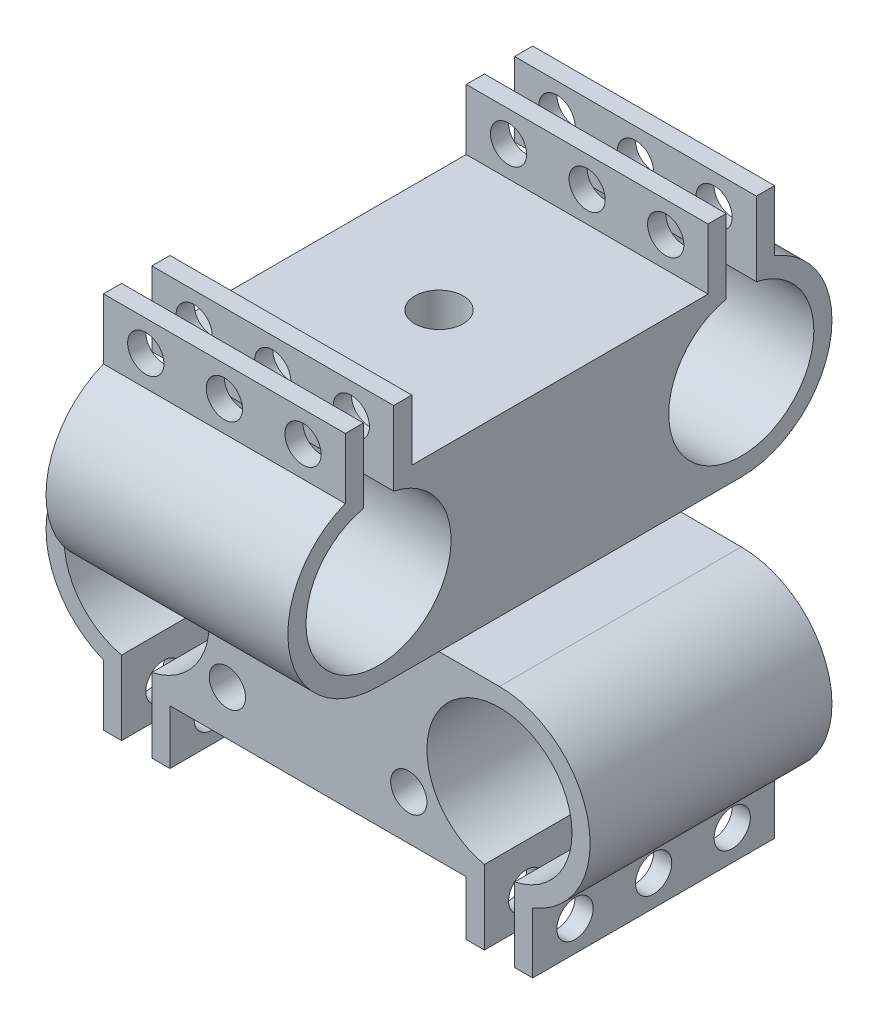
from build123d import *

# Parameters (mm, degrees)
EXTRUDE_1_DEPTH     = 20
SKETCH_2_R          = 1.5
CUT_EXTRUDE_1_DEPTH = 47.519485165
SKETCH_5_W          = 1.5
SKETCH_5_H          = 4.502682252
EXTRUDE_2_DEPTH     = 10
SKETCH_6_R          = 1.5
CUT_EXTRUDE_2_DEPTH = 54.43647957
SKETCH_7_R          = 2
CUT_EXTRUDE_3_DEPTH = 53.126408809
SKETCH_8_R          = 8
CUT_EXTRUDE_4_DEPTH = 10
SKETCH_9_R          = 1.5
CUT_EXTRUDE_5_DEPTH = 54.307080663


with BuildPart() as part:
    # 스케치1 → 보스-돌출1 (new body)
    with BuildSketch(Plane(origin=(0, 0, 0), x_dir=(0, 0, -1), z_dir=(1, 0, 0))):
        with BuildLine():
            ThreePointArc((-12.25, 6.977642868), (-7.631746424, -1.399585383), (-15, -7.5))
            Line((-15, -7.5), (15, -7.5))
            ThreePointArc((15, -7.5), (7.631746424, -1.399585383), (12.25, 6.977642868))
            Line((12.25, 6.977642868), (-12.25, 6.977642868))
        make_face()
        with BuildLine():
            Line((-17.75, 5.332682252), (-17.75, 6.977642868))
            ThreePointArc((-17.75, 6.977642868), (-22.368253576, -1.399585383), (-15, -7.5))
            ThreePointArc((-15, -7.5), (-7.631746424, -1.399585383), (-12.25, 6.977642868))
            Line((-12.25, 6.977642868), (-12.25, 5.332682252))
            ThreePointArc((-12.25, 5.332682252), (-15, -6), (-17.75, 5.332682252))
        make_face()
        with BuildLine():
            ThreePointArc((-13.75, 5.868347297), (-12.982146125, 5.650510219), (-12.25, 5.332682252))
            Line((-12.25, 5.332682252), (-12.25, 6.977642868))
            ThreePointArc((-12.25, 6.977642868), (-12.989137608, 7.225401888), (-13.75, 7.395099729))
            Line((-13.75, 7.395099729), (-13.75, 5.868347297))
        make_face()
        with BuildLine():
            ThreePointArc((-16.25, 7.395099729), (-17.010862392, 7.225401888), (-17.75, 6.977642868))
            Line((-17.75, 6.977642868), (-17.75, 5.332682252))
            ThreePointArc((-17.75, 5.332682252), (-17.017853875, 5.650510219), (-16.25, 5.868347297))
            Line((-16.25, 5.868347297), (-16.25, 7.395099729))
        make_face()
        with BuildLine():
            Line((-16.25, 12), (-17.75, 12))
            Line((-17.75, 12), (-17.75, 6.977642868))
            ThreePointArc((-17.75, 6.977642868), (-17.010862392, 7.225401888), (-16.25, 7.395099729))
            Line((-16.25, 7.395099729), (-16.25, 10.5))
            Line((-16.25, 10.5), (-16.25, 12))
        make_face()
        with BuildLine():
            ThreePointArc((-13.75, 7.395099729), (-12.989137608, 7.225401888), (-12.25, 6.977642868))
            Line((-12.25, 6.977642868), (-12.25, 12))
            Line((-12.25, 12), (-13.75, 12))
            Line((-13.75, 12), (-13.75, 10.5))
            Line((-13.75, 10.5), (-13.75, 7.395099729))
        make_face()
        with BuildLine():
            ThreePointArc((12.25, 6.977642868), (7.631746424, -1.399585383), (15, -7.5))
            ThreePointArc((15, -7.5), (22.368253576, -1.399585383), (17.75, 6.977642868))
            Line((17.75, 6.977642868), (17.75, 5.332682252))
            ThreePointArc((17.75, 5.332682252), (15, -6), (12.25, 5.332682252))
            Line((12.25, 5.332682252), (12.25, 6.977642868))
        make_face()
        with BuildLine():
            Line((17.75, 5.332682252), (17.75, 6.977642868))
            ThreePointArc((17.75, 6.977642868), (17.010862392, 7.225401888), (16.25, 7.395099729))
            Line((16.25, 7.395099729), (16.25, 5.868347297))
            ThreePointArc((16.25, 5.868347297), (17.017853875, 5.650510219), (17.75, 5.332682252))
        make_face()
        with BuildLine():
            ThreePointArc((16.25, 7.395099729), (17.010862392, 7.225401888), (17.75, 6.977642868))
            Line((17.75, 6.977642868), (17.75, 12))
            Line((17.75, 12), (16.25, 12))
            Line((16.25, 12), (16.25, 10.5))
            Line((16.25, 10.5), (16.25, 7.395099729))
        make_face()
        with BuildLine():
            Line((12.25, 12), (12.25, 6.977642868))
            ThreePointArc((12.25, 6.977642868), (12.989137608, 7.225401888), (13.75, 7.395099729))
            Line((13.75, 7.395099729), (13.75, 10.5))
            Line((13.75, 10.5), (13.75, 12))
            Line((13.75, 12), (12.25, 12))
        make_face()
        with BuildLine():
            ThreePointArc((13.75, 7.395099729), (12.989137608, 7.225401888), (12.25, 6.977642868))
            Line((12.25, 6.977642868), (12.25, 5.332682252))
            ThreePointArc((12.25, 5.332682252), (12.982146125, 5.650510219), (13.75, 5.868347297))
            Line((13.75, 5.868347297), (13.75, 7.395099729))
        make_face()
    extrude(amount=EXTRUDE_1_DEPTH)

    # 스케치2 → 컷-돌출1 (cut, through all)
    with BuildSketch(Plane.XY.offset(17.75)):
        with Locations((3.5, 9.488821434)):
            Circle(SKETCH_2_R)
        with Locations((10, 9.488821434)):
            Circle(SKETCH_2_R)
        with Locations(Location((16.5, 9.488821434, 0), (0, 0, 90))):
            Circle(SKETCH_2_R)
    extrude(amount=-CUT_EXTRUDE_1_DEPTH, mode=Mode.SUBTRACT)

    # 스케치5 → 보스-돌출2 (add, symmetric)
    with BuildSketch(Plane.XY):
        with BuildLine():
            ThreePointArc((32.5, -15), (30.303300859, -9.696699141), (25, -7.5))
            ThreePointArc((25, -7.5), (17.631746424, -13.600414617), (22.25, -21.977642868))
            Line((22.25, -21.977642868), (22.25, -20.332682252))
            ThreePointArc((22.25, -20.332682252), (21.877501001, -9.876524617), (31, -15))
            ThreePointArc((31, -15), (30.123475383, -18.122498999), (27.75, -20.332682252))
            Line((27.75, -20.332682252), (27.75, -21.977642868))
            ThreePointArc((27.75, -21.977642868), (31.199798384, -19.220485754), (32.5, -15))
        make_face()
        with BuildLine():
            Line((22.25, -20.332682252), (22.25, -21.977642868))
            ThreePointArc((22.25, -21.977642868), (22.989137608, -22.225401888), (23.75, -22.395099729))
            Line((23.75, -22.395099729), (23.75, -20.868347297))
            ThreePointArc((23.75, -20.868347297), (22.982146125, -20.650510219), (22.25, -20.332682252))
        make_face()
        with BuildLine():
            ThreePointArc((26.25, -22.395099729), (27.010862392, -22.225401888), (27.75, -21.977642868))
            Line((27.75, -21.977642868), (27.75, -20.332682252))
            ThreePointArc((27.75, -20.332682252), (27.017853875, -20.650510219), (26.25, -20.868347297))
            Line((26.25, -20.868347297), (26.25, -22.395099729))
        make_face()
        with BuildLine():
            Line((27.75, -27.002682252), (27.75, -21.977642868))
            ThreePointArc((27.75, -21.977642868), (27.010862392, -22.225401888), (26.25, -22.395099729))
            Line((26.25, -22.395099729), (26.25, -27.002682252))
            Line((26.25, -27.002682252), (27.75, -27.002682252))
        make_face()
        with BuildLine():
            ThreePointArc((23.75, -22.395099729), (22.989137608, -22.225401888), (22.25, -21.977642868))
            Line((22.25, -21.977642868), (22.25, -22.5))
            Line((22.25, -22.5), (23.75, -22.5))
            Line((23.75, -22.5), (23.75, -22.395099729))
        make_face()
        with Locations((23, -24.751341126)):
            Rectangle(SKETCH_5_W, SKETCH_5_H)
        with BuildLine():
            ThreePointArc((22.25, -21.977642868), (17.631746424, -13.600414617), (25, -7.5))
            Line((25, -7.5), (20, -7.5))
            Line((20, -7.5), (0, -7.5))
            Line((0, -7.5), (-5, -7.5))
            ThreePointArc((-5, -7.5), (0.303300859, -9.696699141), (2.5, -15))
            ThreePointArc((2.5, -15), (1.199798384, -19.220485754), (-2.25, -21.977642868))
            Line((-2.25, -21.977642868), (-2.25, -22.5))
            Line((-2.25, -22.5), (22.25, -22.5))
            Line((22.25, -22.5), (22.25, -21.977642868))
        make_face()
        with BuildLine():
            ThreePointArc((2.5, -15), (0.303300859, -9.696699141), (-5, -7.5))
            ThreePointArc((-5, -7.5), (-12.368253576, -13.600414617), (-7.75, -21.977642868))
            Line((-7.75, -21.977642868), (-7.75, -20.332682252))
            ThreePointArc((-7.75, -20.332682252), (-8.122498999, -9.876524617), (1, -15))
            ThreePointArc((1, -15), (0.123475383, -18.122498999), (-2.25, -20.332682252))
            Line((-2.25, -20.332682252), (-2.25, -21.977642868))
            ThreePointArc((-2.25, -21.977642868), (1.199798384, -19.220485754), (2.5, -15))
        make_face()
        with BuildLine():
            Line((-7.75, -20.332682252), (-7.75, -21.977642868))
            ThreePointArc((-7.75, -21.977642868), (-7.010862392, -22.225401888), (-6.25, -22.395099729))
            Line((-6.25, -22.395099729), (-6.25, -20.868347297))
            ThreePointArc((-6.25, -20.868347297), (-7.017853875, -20.650510219), (-7.75, -20.332682252))
        make_face()
        with BuildLine():
            ThreePointArc((-6.25, -22.395099729), (-7.010862392, -22.225401888), (-7.75, -21.977642868))
            Line((-7.75, -21.977642868), (-7.75, -27.002682252))
            Line((-7.75, -27.002682252), (-6.25, -27.002682252))
            Line((-6.25, -27.002682252), (-6.25, -22.395099729))
        make_face()
        with BuildLine():
            Line((-3.75, -22.5), (-2.25, -22.5))
            Line((-2.25, -22.5), (-2.25, -21.977642868))
            ThreePointArc((-2.25, -21.977642868), (-2.989137608, -22.225401888), (-3.75, -22.395099729))
            Line((-3.75, -22.395099729), (-3.75, -22.5))
        make_face()
        with Locations((-3, -24.751341126)):
            Rectangle(SKETCH_5_W, SKETCH_5_H)
        with BuildLine():
            ThreePointArc((-3.75, -22.395099729), (-2.989137608, -22.225401888), (-2.25, -21.977642868))
            Line((-2.25, -21.977642868), (-2.25, -20.332682252))
            ThreePointArc((-2.25, -20.332682252), (-2.982146125, -20.650510219), (-3.75, -20.868347297))
            Line((-3.75, -20.868347297), (-3.75, -22.395099729))
        make_face()
    extrude(amount=EXTRUDE_2_DEPTH, both=True)

    # 스케치6 → 컷-돌출2 (cut, through all)
    with BuildSketch(Plane(origin=(27.75, 0, 0), x_dir=(0, 0, -1), z_dir=(1, 0, 0))):
        with Locations((-6.5, -24.49016256)):
            Circle(SKETCH_6_R)
        with Locations((0, -24.49016256)):
            Circle(SKETCH_6_R)
        with Locations((6.5, -24.49016256)):
            Circle(SKETCH_6_R)
    extrude(amount=-CUT_EXTRUDE_2_DEPTH, mode=Mode.SUBTRACT)

    # 스케치7 → 컷-돌출3 (cut, through all)
    with BuildSketch(Plane(origin=(0, 6.977642868, 0), x_dir=(1, 0, 0), z_dir=(0, 1, 0))):
        with Locations(Location((10, 0, 0), (0, 0, 270))):
            Circle(SKETCH_7_R)
    extrude(amount=-CUT_EXTRUDE_3_DEPTH, mode=Mode.SUBTRACT)

    # 스케치8 → 컷-돌출4 (cut)
    with BuildSketch(Plane.XZ.offset(22.5)):
        with Locations(Location((10, 0, 0), (0, 0, 270))):
            Circle(SKETCH_8_R)
    extrude(amount=-CUT_EXTRUDE_4_DEPTH, mode=Mode.SUBTRACT)

    # 스케치9 → 컷-돌출5 (cut, through all)
    with BuildSketch(Plane.XY.offset(10)):
        with Locations((17.5, -18.8)):
            Circle(SKETCH_9_R)
        with Locations((2.5, -18.8)):
            Circle(SKETCH_9_R)
    extrude(amount=-CUT_EXTRUDE_5_DEPTH, mode=Mode.SUBTRACT)


solid = part.part
